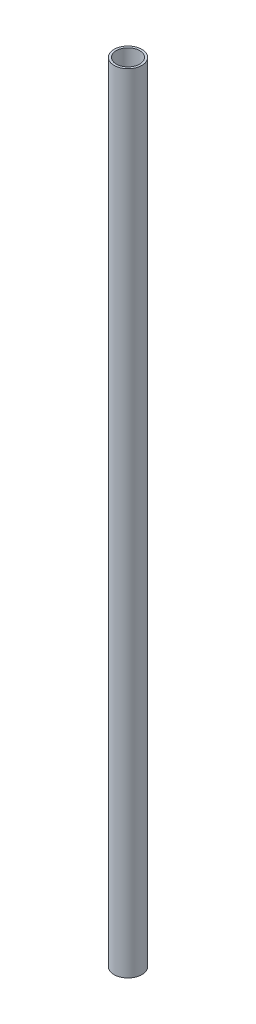
from build123d import *

# Parameters (mm, degrees)
SKETCH1_R           = 15.905
SKETCH1_R_2         = 13.405
BOSS_EXTRUDE1_DEPTH = 900


with BuildPart() as part:
    # Sketch1 → Boss-Extrude1 (new body)
    with BuildSketch(Plane(origin=(0, 0, 0), x_dir=(1, 0, 0), z_dir=(0, 1, 0))):
        with Locations(Location((0, 0, 0), (0, 0, 270))):
            Circle(SKETCH1_R)
        with Locations(Location((0, 0, 0), (0, 0, 270))):
            Circle(SKETCH1_R_2, mode=Mode.SUBTRACT)
    extrude(amount=-BOSS_EXTRUDE1_DEPTH)


solid = part.part
